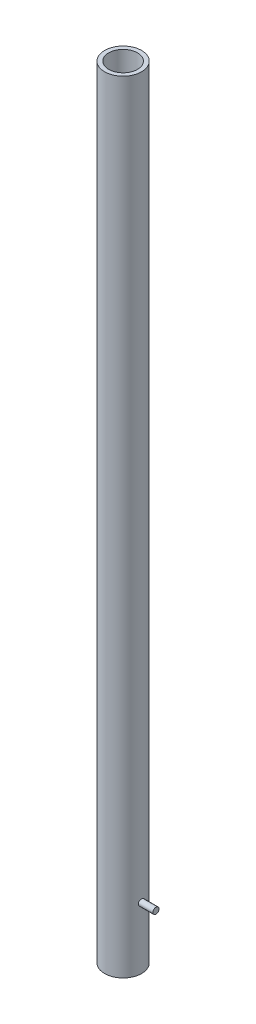
from build123d import *

# Parameters (mm, degrees)
SKETCH1_R                            = 9
SKETCH1_R_2                          = 7
EXTRUDE_THIN1_DEPTH                  = 380
BOSS_EXTRUDE1_REACH                  = 382.213
BOSS_EXTRUDE1_END_RADIUS             = 7
SKETCH2_R                            = 1.5
BOSS_EXTRUDE1_DIRECTION_2_REACH      = 382.213
BOSS_EXTRUDE1_DIRECTION_2_END_RADIUS = 7
BOSS_EXTRUDE2_START                  = 8
SKETCH3_R                            = 1.5
BOSS_EXTRUDE2_DEPTH                  = 8


with BuildPart() as part:
    # Sketch1 → Extrude-Thin1 (new body)
    with BuildSketch(Plane(origin=(0, 0, 0), x_dir=(1, 0, 0), z_dir=(0, 1, 0))):
        Circle(SKETCH1_R)
        Circle(SKETCH1_R_2, mode=Mode.SUBTRACT)
    extrude(amount=EXTRUDE_THIN1_DEPTH)

    # Boss-Extrude1: up to this cylinder (the profile starts inside it)
    boss_extrude1_end = Plane(origin=(0, 4.5, 0), z_dir=(0, -1, 0)) * Cylinder(BOSS_EXTRUDE1_END_RADIUS, 779.426, mode=Mode.PRIVATE)
    # Sketch2 → Boss-Extrude1 (add, up to the surface)
    with BuildSketch(Plane(origin=(0, 0, 0), x_dir=(0, 0, -1), z_dir=(1, 0, 0)), mode=Mode.PRIVATE) as boss_extrude1_sk1:
        with Locations((0, 4.5)):
            Circle(SKETCH2_R)
    boss_extrude1_tool1 = extrude(boss_extrude1_sk1.sketch, amount=BOSS_EXTRUDE1_REACH, mode=Mode.PRIVATE) & boss_extrude1_end
    add(boss_extrude1_tool1.solids().sort_by_distance((0, 4.5, 0))[0])

    # Boss-Extrude1 direction 2: up to this cylinder (the profile starts inside it)
    boss_extrude1_direction_2_end = Plane(origin=(0, 4.5, 0), z_dir=(0, -1, 0)) * Cylinder(BOSS_EXTRUDE1_DIRECTION_2_END_RADIUS, 779.426, mode=Mode.PRIVATE)
    # Sketch2 → Boss-Extrude1 direction 2 (add, up to the surface)
    with BuildSketch(Plane(origin=(0, 0, 0), x_dir=(0, 0, -1), z_dir=(1, 0, 0)), mode=Mode.PRIVATE) as boss_extrude1_direction_2_sk1:
        with Locations((0, 4.5)):
            Circle(SKETCH2_R)
    boss_extrude1_direction_2_tool1 = extrude(boss_extrude1_direction_2_sk1.sketch, amount=-BOSS_EXTRUDE1_DIRECTION_2_REACH, mode=Mode.PRIVATE) & boss_extrude1_direction_2_end
    add(boss_extrude1_direction_2_tool1.solids().sort_by_distance((0, 4.5, 0))[0])

    # Sketch3 → Boss-Extrude2 (add)
    with BuildSketch(Plane(origin=(0, 0, 0), x_dir=(0, 0, -1), z_dir=(1, 0, 0)).offset(BOSS_EXTRUDE2_START)):
        with Locations(Location((0, 30, 0), (0, 0, 180))):
            Circle(SKETCH3_R)
    extrude(amount=BOSS_EXTRUDE2_DEPTH)


solid = part.part
